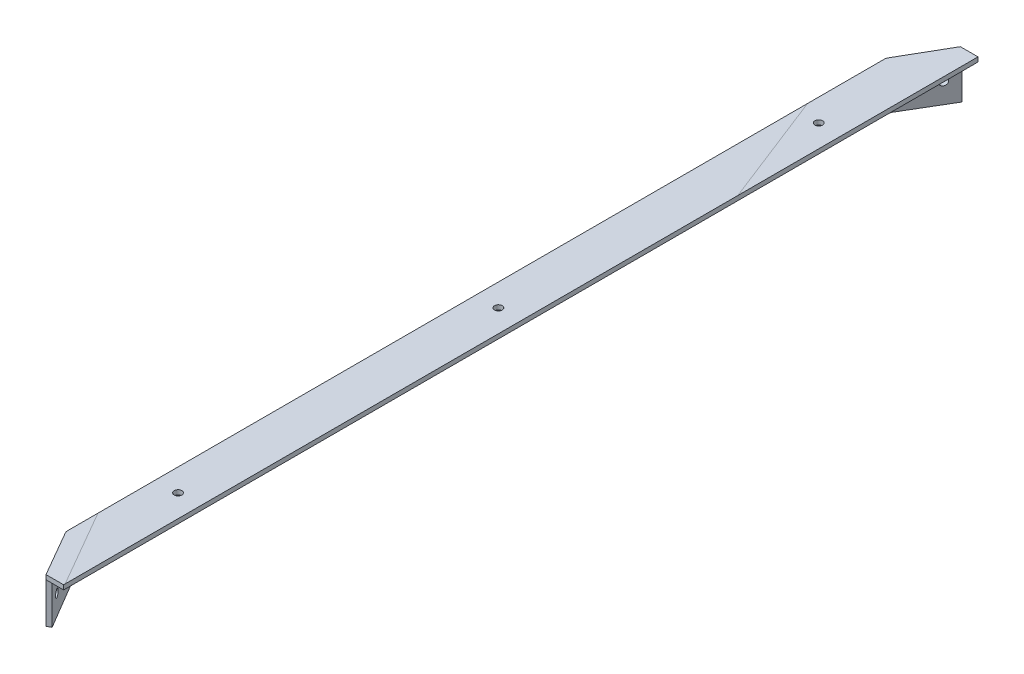
from build123d import *
from build123d.topology import SkipClean

# Parameters (mm, degrees)
BOSS_EXTRUDE1_DEPTH = 640
SKETCH22_R          = 6
CUT_EXTRUDE4_DEPTH  = 10
BOSS_EXTRUDE2_DEPTH = 63
BOSS_EXTRUDE3_DEPTH = 7
SKETCH26_R          = 6
CUT_EXTRUDE5_DEPTH  = 7
FILLET1_R           = 10
FILLET2_R           = 10


with BuildPart() as part:
    # Sketch1 → Boss-Extrude1 (new body)
    with BuildSketch(Plane.XY):
        Polygon((0, 0), (0, 70), (70, 70), (70, 63), (7, 63), (7, 0), align=None)
    extrude(amount=BOSS_EXTRUDE1_DEPTH)

    # Sketch22 → Cut-Extrude4 (cut)
    with BuildSketch(Plane(origin=(0, 70, 0), x_dir=(1, 0, 0), z_dir=(0, 1, 0))):
        with Locations((35, 0)):
            Circle(SKETCH22_R)
        with Locations((35, 500)):
            Circle(SKETCH22_R)
        with Locations(Location((35, -500, 0), (0, 0, 270))):
            Circle(SKETCH22_R)
    extrude(amount=-CUT_EXTRUDE4_DEPTH, mode=Mode.SUBTRACT)

    # Sketch23 → Boss-Extrude2 (add)
    with BuildSketch(Plane(origin=(0, 0, 0), x_dir=(1, 0, 0), z_dir=(0, 1, 0))):
        Polygon((0, -640), (42.5, -713.612159322), (48.562177826, -710.112159322), (7, -640), align=None)
    extrude(amount=BOSS_EXTRUDE2_DEPTH)

    # Sketch25 → Boss-Extrude3 (add)
    with BuildSketch(Plane(origin=(0, 63, 0), x_dir=(1, 0, 0), z_dir=(0, 1, 0))):
        Polygon((70, -640), (0, -640), (42.5, -713.612159322), (70, -713.612159322), align=None)
    extrude(amount=BOSS_EXTRUDE3_DEPTH)

    # Sketch26 → Cut-Extrude5 (cut)
    with BuildSketch(Plane(origin=(-275.556719825, 0, 163.348804279), x_dir=(-0.5099316128113042, 0, -0.8602149442178172), z_dir=(0.8602149442178172, 0, -0.5099316128113042))):
        with Locations((-614.36248118, 31.5)):
            Circle(SKETCH26_R)
        with Locations((-575.367085589, 31.5)):
            Circle(SKETCH26_R)
    extrude(amount=-CUT_EXTRUDE5_DEPTH, mode=Mode.SUBTRACT)

    # Mirror1: part across plane


with BuildPart() as part_1:
    with SkipClean():  # the faces are left unmerged after this step: merging them gives an invalid solid
        add(part.part)
        add(part.part.mirror(Plane.XY))

    # Fillet1
    fillet1_edges = [part_1.edges().sort_by_distance(p)[0] for p in [
        (0, 35, 640),
        (0, 35, -640),
    ]]
    fillet(fillet1_edges, radius=FILLET1_R)

    # Fillet2
    fillet2_edges = [part_1.edges().sort_by_distance(p)[0] for p in [
        (7, 31.5, -640),
        (7, 31.5, 640),
    ]]
    fillet(fillet2_edges, radius=FILLET2_R)


solid = part_1.part
